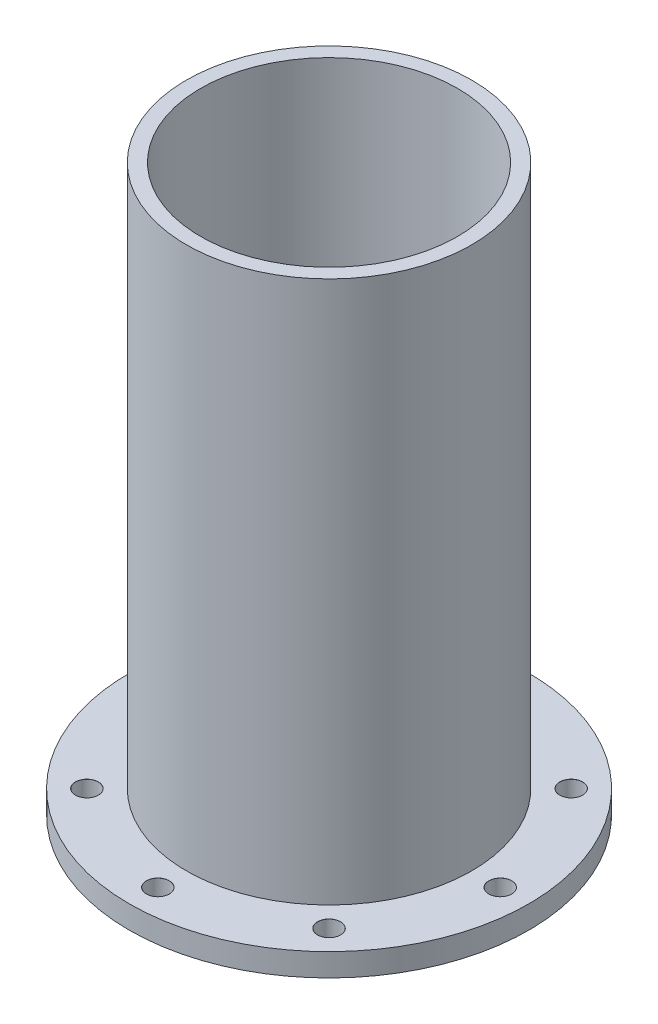
from build123d import *

# Parameters (mm, degrees)
SKETCH_1_W               = 70
SKETCH_1_H               = 8
M8X1_0_2_D               = 8
M8X1_0_2_CSINK_D         = 8.05
M8X1_0_2_CSINK_ANGLE     = 100
PATTERN_CIRCULAR_2_COUNT = 8
SKETCH_11_W              = 50
SKETCH_11_H              = 190
SKETCH_12_R              = 45
CUT_EXTRUDE_1_DEPTH      = 222.368471106


with BuildPart() as part:
    # 草图1 → 旋转1 (revolve)
    with BuildSketch(Plane.XY):
        with Locations((-35, 4)):
            Rectangle(SKETCH_1_W, SKETCH_1_H)
    revolve(axis=Axis((0, 76.619497233, 0), (0, -1, 0)))

    # M8x1.0 螺纹孔2 (through all)
    with Locations(Plane(origin=(0, 8, 0), x_dir=(1, 0, 0), z_dir=(0, 1, 0))):
        with Locations((-60, 0)):
            m8x1_0_2 = CounterSinkHole(M8X1_0_2_D / 2, M8X1_0_2_CSINK_D / 2, counter_sink_angle=M8X1_0_2_CSINK_ANGLE)

    # 阵列(圆周)2: M8x1.0 螺纹孔2 ×8 about axis
    pattern_circular_2_axis = Axis((0, 76.619497233, 0), (0, -1, 0))
    for i in range(1, PATTERN_CIRCULAR_2_COUNT):
        add(m8x1_0_2.rotate(pattern_circular_2_axis, i * 360 / PATTERN_CIRCULAR_2_COUNT), mode=Mode.SUBTRACT)

    # 草图11 → 旋转2 (revolve)
    with BuildSketch(Plane.XY):
        with Locations((-25, 103)):
            Rectangle(SKETCH_11_W, SKETCH_11_H)
    revolve(axis=Axis((0, 8, 0), (0, 1, 0)))

    # 草图12 → 切除-拉伸1 (cut, through all)
    with BuildSketch(Plane.XZ):
        Circle(SKETCH_12_R)
    extrude(amount=-CUT_EXTRUDE_1_DEPTH, mode=Mode.SUBTRACT)


solid = part.part
